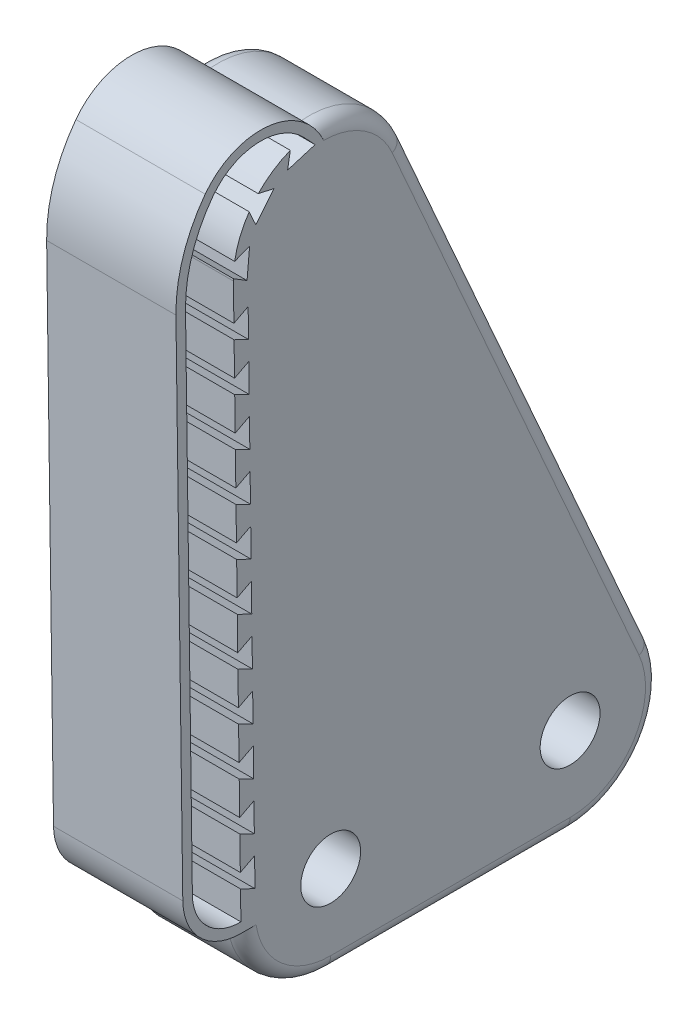
from build123d import *

# Parameters (mm, degrees)
BOSS_EXTRUDE1_DEPTH = 6.35
SKETCH2_R           = 1.5875
CUT_EXTRUDE1_DEPTH  = 38.1
CUT_EXTRUDE2_DEPTH  = 6.35
LPATTERN1_COUNT     = 11
LPATTERN1_PITCH     = 2.54
CUT_EXTRUDE3_START  = -6.35
CUT_EXTRUDE3_DEPTH  = 6.35
CIRPATTERN1_COUNT   = 3
CIRPATTERN1_ANGLE   = 68
BOSS_EXTRUDE2_DEPTH = 6.35
BOSS_EXTRUDE3_START = 0.508
BOSS_EXTRUDE3_DEPTH = 0.508
FILLET3_R           = 0.762


with BuildPart() as part:
    # Sketch1 → Boss-Extrude1 (new body)
    with BuildSketch(Plane(origin=(0, 0, 0), x_dir=(0, 0, -1), z_dir=(1, 0, 0))):
        with BuildLine():
            Line((0, -4.7625), (12.7, -4.7625))
            ThreePointArc((12.7, -4.7625), (16.69058737, -2.599349668), (17.05608691, 1.925074826))
            Line((17.05608691, 1.925074826), (3.957741706, 31.564198098))
            ThreePointArc((3.957741706, 31.564198098), (-1.413387908, 34.29219694), (-5.160415138, 29.575121793))
            Line((-5.160415138, 29.575121793), (-4.762069934, -0.064001479))
            ThreePointArc((-4.762069934, -0.064001479), (-3.344891568, -3.39014847), (0, -4.7625))
        make_face()
    extrude(amount=BOSS_EXTRUDE1_DEPTH)

    # Sketch2 → Cut-Extrude1 (cut)
    with BuildSketch(Plane(origin=(6.35, 0, 0), x_dir=(0, 0, -1), z_dir=(1, 0, 0))):
        Circle(SKETCH2_R)
        with Locations((12.7, 0)):
            Circle(SKETCH2_R)
    extrude(amount=-CUT_EXTRUDE1_DEPTH, mode=Mode.SUBTRACT)

    # Sketch3 → Cut-Extrude2 (cut)
    with BuildSketch(Plane(origin=(6.35, 0, 0), x_dir=(0, 0, -1), z_dir=(1, 0, 0))):
        Polygon((-4.782550408, 1.4598609), (-4.792790644, 2.22179209), (-4.035979573, 2.612997921), (-4.0154991, 1.089135542), align=None)
    cut_extrude2 = extrude(amount=-CUT_EXTRUDE2_DEPTH, mode=Mode.SUBTRACT)

    # LPattern1: Cut-Extrude2 ×11
    with Locations(*[Vector(0, 0.9999096975250266, 0.013438630711869543) * (i * LPATTERN1_PITCH) for i in range(1, LPATTERN1_COUNT)]):
        add(cut_extrude2, mode=Mode.SUBTRACT)

    # Sketch5 → Cut-Extrude3 (cut)
    with BuildSketch(Plane(origin=(6.35, 0, 0), x_dir=(0, 0, -1), z_dir=(1, 0, 0)).offset(CUT_EXTRUDE3_START)):
        with BuildLine():
            Line((-2.14250095, 34.070751301), (-2.285611832, 33.230915438))
            Line((-2.285611832, 33.230915438), (-0.827385747, 33.673806717))
            Line((-0.827385747, 33.673806717), (-1.413387908, 34.29219694))
            ThreePointArc((-1.413387908, 34.29219694), (-1.782380451, 34.196079788), (-2.14250095, 34.070751301))
        make_face()
    cut_extrude3 = extrude(amount=CUT_EXTRUDE3_DEPTH, mode=Mode.SUBTRACT)

    # CirPattern1: Cut-Extrude3 ×3 about axis
    cirpattern1_axis = Axis((0, 29.639123272, 0.398345204), (1, 0, 0))
    for i in range(1, CIRPATTERN1_COUNT):
        add(cut_extrude3.rotate(cirpattern1_axis, i * CIRPATTERN1_ANGLE / (CIRPATTERN1_COUNT - 1)), mode=Mode.SUBTRACT)

    # Sketch6 → Boss-Extrude2 (add)
    with BuildSketch(Plane(origin=(0, 0, 0), x_dir=(0, 0, -1), z_dir=(1, 0, 0))):
        with BuildLine():
            Line((-7.335974688, 2.441635031), (-7.70018577, 29.540987671))
            ThreePointArc((-7.70018577, 29.540987671), (-7.343715671, 31.89485715), (-6.249061464, 34.008977446))
            ThreePointArc((-6.249061464, 34.008977446), (-3.897096462, 35.275278165), (-1.413387908, 34.29219694))
            ThreePointArc((-1.413387908, 34.29219694), (-1.118769293, 34.346818609), (-0.821298902, 34.382805009))
            ThreePointArc((-0.821298902, 34.382805009), (-3.75592559, 35.788432355), (-6.656067812, 34.312967301))
            ThreePointArc((-6.656067812, 34.312967301), (-7.826871877, 32.051777768), (-8.208139896, 29.534160847))
            Line((-8.208139896, 29.534160847), (-7.844020566, 2.441635031))
            ThreePointArc((-7.844020566, 2.441635031), (-6.92684089, 0.288995326), (-4.762069934, -0.599172997))
            Line((-4.762069934, -0.599172997), (-4.724658503, -0.599172997))
            ThreePointArc((-4.724658503, -0.599172997), (-4.750905835, -0.332114438), (-4.762069934, -0.064001479))
            ThreePointArc((-4.762069934, -0.064001479), (-6.567956624, 0.655743647), (-7.335974688, 2.441635031))
        make_face()
    extrude(amount=BOSS_EXTRUDE2_DEPTH)

    # Sketch7 → Boss-Extrude3 (add)
    with BuildSketch(Plane.ZY.offset(BOSS_EXTRUDE3_START)):
        with BuildLine():
            Line((3.890529822, 29.592188854), (3.484762618, -0.599172997))
            Line((3.484762618, -0.599172997), (4.762069934, -0.599172997))
            ThreePointArc((4.762069934, -0.599172997), (6.92684089, 0.288995326), (7.844020566, 2.441635031))
            Line((7.844020566, 2.441635031), (8.208139896, 29.534160847))
            ThreePointArc((8.208139896, 29.534160847), (7.826871877, 32.051777768), (6.656067812, 34.312967301))
            ThreePointArc((6.656067812, 34.312967301), (3.75592559, 35.788432355), (0.821298902, 34.382805009))
            Line((0.821298902, 34.382805009), (-0.201439925, 33.079735725))
            ThreePointArc((-0.201439925, 33.079735725), (2.663789861, 32.297189628), (3.890529822, 29.592188854))
        make_face()
    extrude(amount=-BOSS_EXTRUDE3_DEPTH)

    # Fillet3
    fillet3_edges = [part.edges().sort_by_distance(p)[0] for p in [
        (6.35, -2.599349668, -16.69058737),
        (6.35, 16.744636462, -10.506914308),
        (6.35, 33.741303888, -2.021059773),
        (0, -3.573161601, 3.148638186),
        (6.35, -3.573161601, 3.148638186),
        (0, 33.741303888, -2.021059773),
        (0, 16.744636462, -10.506914308),
        (6.35, -4.7625, -6.35),
        (0, -2.599349668, -16.69058737),
        (0, -4.7625, -6.35),
    ]]
    fillet(fillet3_edges, radius=FILLET3_R)


solid = part.part
